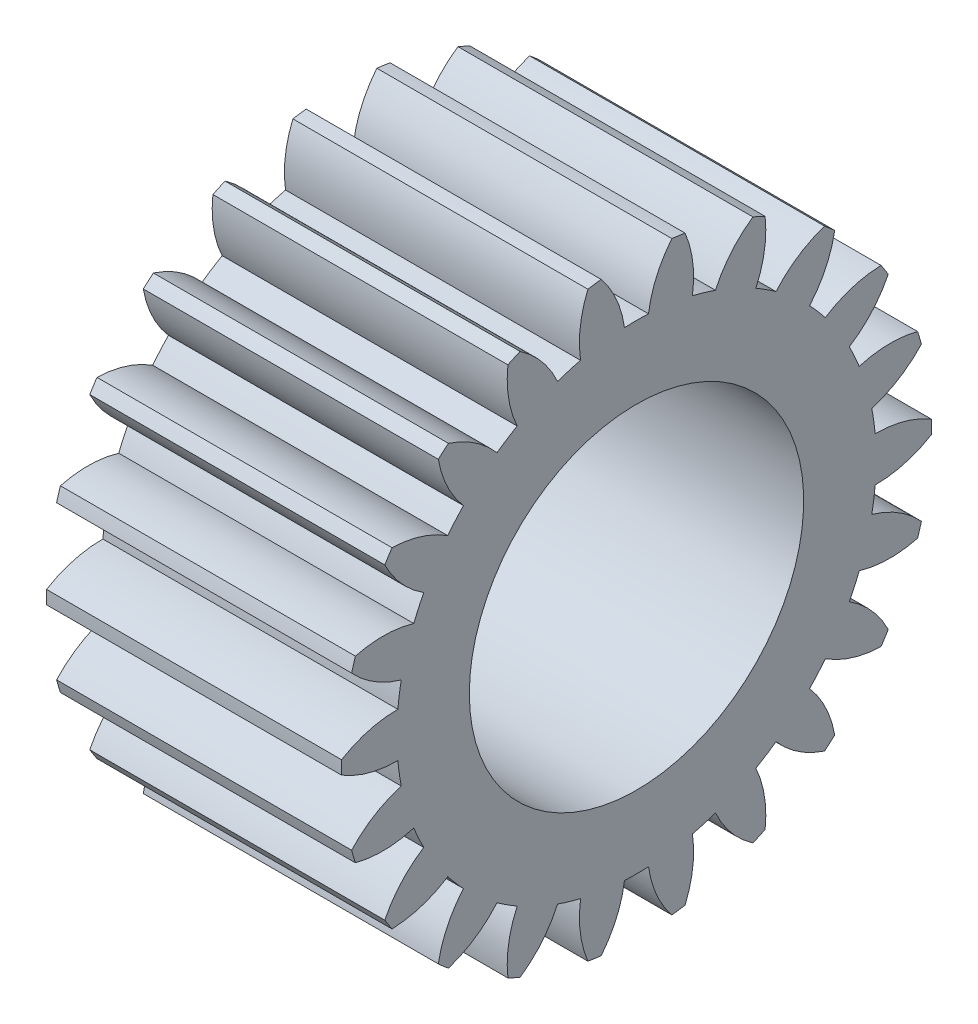
from build123d import *

# Parameters (mm, degrees)
BASPROSKE_W     = 15
BASPROSKE_H     = 15
TOOTHCUT_DEPTH  = 26.980762114
TEETHCUTS_COUNT = 22
TEETHCUTS_ANGLE = 343.636363636
BORSKE_R        = 8.5
BORE_DEPTH      = 50.0000508


with BuildPart() as part:
    # BasProSke → Base-Revolve (revolve)
    with BuildSketch(Plane(origin=(0, 0, 0), x_dir=(1, 0, 0), z_dir=(0, 1, 0)), mode=Mode.PRIVATE) as base_revolve_sk:
        with Locations((7.5, 7.5)):
            Rectangle(BASPROSKE_W, BASPROSKE_H)
    revolve(base_revolve_sk.sketch.rotate(Axis((-10, 0, 0), (1, 0, 0)), 180), axis=Axis((-10, 0, 0), (1, 0, 0)))

    # TooCutSke → ToothCut (cut, through all)
    with BuildSketch(Plane(origin=(0, 0, 0), x_dir=(0, 0, -1), z_dir=(1, 0, 0))):
        with BuildLine():
            ThreePointArc((0.609906099, 12.171228237), (0, 12.1865), (-0.609906099, 12.171228237))
            ThreePointArc((-0.609906099, 12.171228237), (-1.022716454, 13.626997902), (-1.81660957, 14.915179343))
            ThreePointArc((-1.81660957, 14.915179343), (0, 15.0254), (1.81660957, 14.915179343))
            ThreePointArc((1.81660957, 14.915179343), (1.022716454, 13.626997902), (0.609906099, 12.171228237))
        make_face()
    toothcut = extrude(amount=TOOTHCUT_DEPTH, mode=Mode.SUBTRACT)

    # TeethCuts: ToothCut ×22 about axis
    teethcuts_axis = Axis((-10, 0, 0), (1, 0, 0))
    for i in range(1, TEETHCUTS_COUNT):
        add(toothcut.rotate(teethcuts_axis, i * TEETHCUTS_ANGLE / (TEETHCUTS_COUNT - 1)), mode=Mode.SUBTRACT)

    # BorSke → Bore (cut, symmetric)
    with BuildSketch(Plane(origin=(0, 0, 0), x_dir=(0, 0, -1), z_dir=(1, 0, 0))):
        with Locations(Location((0, 0, 0), (0, 0, 180))):
            Circle(BORSKE_R)
    extrude(amount=BORE_DEPTH, both=True, mode=Mode.SUBTRACT)


solid = part.part
